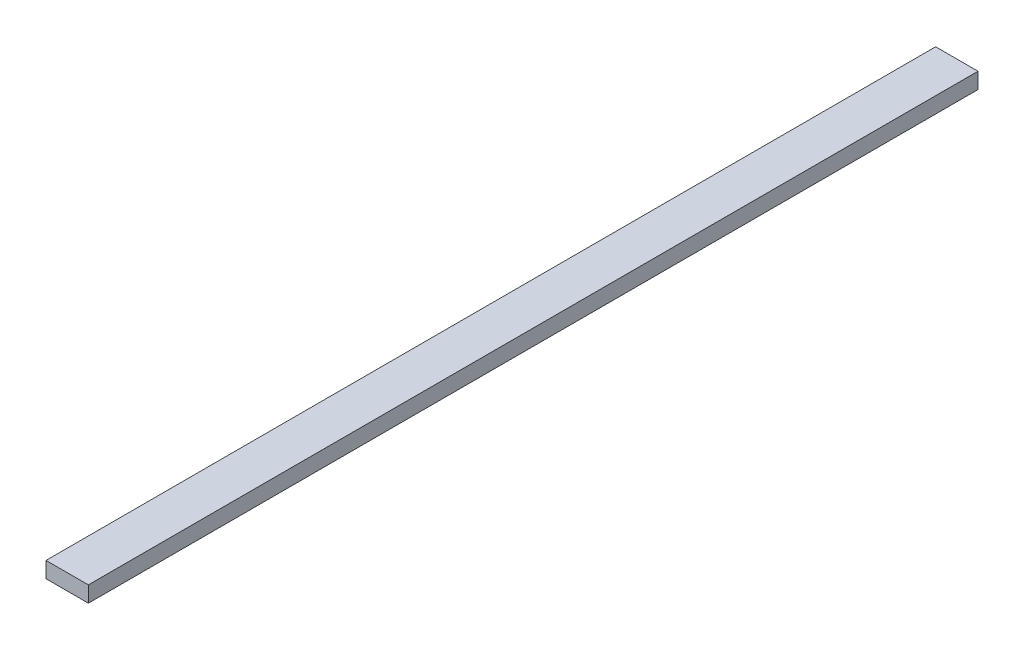
from build123d import *

# Parameters (mm, degrees)
SKETCH1_W           = 50.8
SKETCH1_H           = 1066.8
BOSS_EXTRUDE1_DEPTH = 19.05


with BuildPart() as part:
    # Sketch1 → Boss-Extrude1 (new body)
    with BuildSketch(Plane(origin=(0, 0, 0), x_dir=(1, 0, 0), z_dir=(0, 1, 0))):
        Rectangle(SKETCH1_W, SKETCH1_H)
    extrude(amount=BOSS_EXTRUDE1_DEPTH)


solid = part.part
